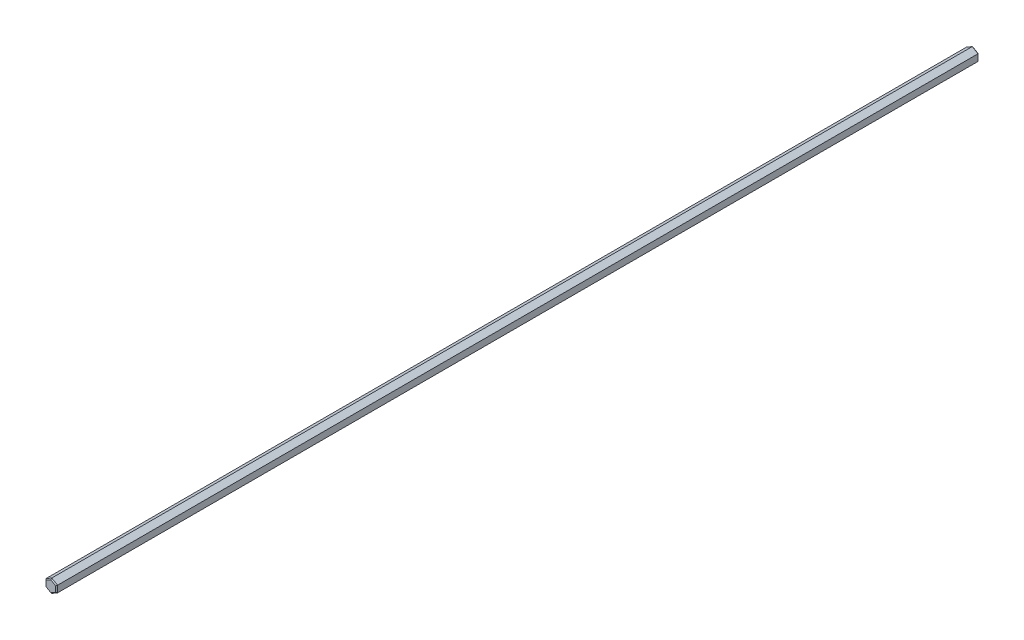
from build123d import *

# Parameters (mm, degrees)
BOSS_EXTRUDE1_DEPTH = 400
CHAMFER1_SIZE       = 0.4


with BuildPart() as part:
    # Sketch1 → Boss-Extrude1 (new body)
    with BuildSketch(Plane.XY.offset(355)):
        Polygon((0, -2.886751346), (2.5, -1.443375673), (2.5, 1.443375673), (0, 2.886751346), (-2.5, 1.443375673), (-2.5, -1.443375673), align=None)
    extrude(amount=-BOSS_EXTRUDE1_DEPTH)

    # Chamfer1
    chamfer1_edges = [part.edges().sort_by_distance(p)[0] for p in [
        (2.5, 0, -45),
        (1.25, 2.165063509, -45),
        (-1.25, 2.165063509, -45),
        (-2.5, 0, -45),
        (-1.25, -2.165063509, -45),
        (-2.5, 0, 355),
        (-1.25, 2.165063509, 355),
        (1.25, 2.165063509, 355),
        (1.25, -2.165063509, -45),
        (2.5, 0, 355),
        (1.25, -2.165063509, 355),
        (-1.25, -2.165063509, 355),
    ]]
    chamfer(chamfer1_edges, length=CHAMFER1_SIZE)


solid = part.part
